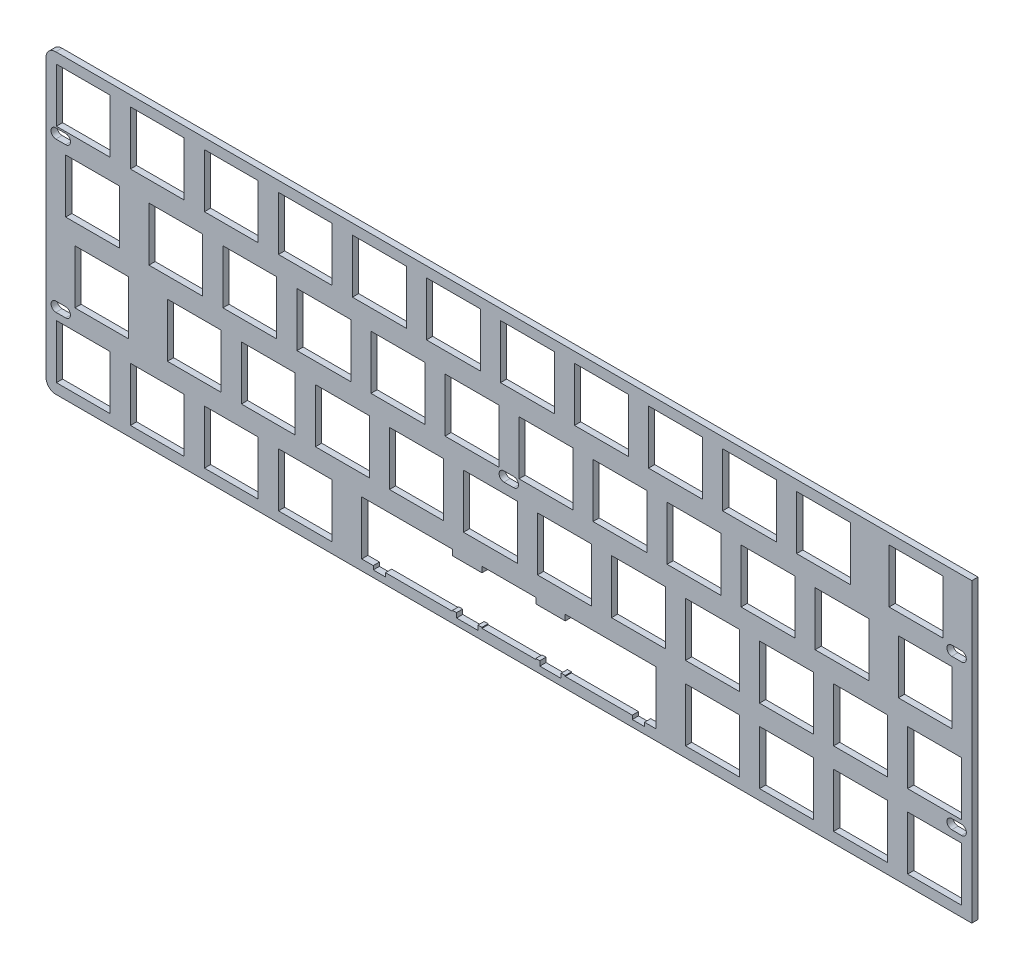
from build123d import *

# Parameters (mm, degrees)
MODEL_W             = 238.2749154
MODEL_H             = 76.350013
MODEL_W_2           = 13.849
MODEL_H_2           = 13.84926
MODEL_W_3           = 13.8491
MODEL_W_4           = 13.84934
MODEL_H_3           = 13.8492
MODEL_W_5           = 13.85
MODEL_W_6           = 13.8504
MODEL_W_7           = 13.85071
MODEL_W_8           = 13.851
MODEL_H_4           = 13.849
MODEL_W_9           = 13.8505
MODEL_W_10          = 13.84928
BOSS_EXTRUDE1_DEPTH = 1.6
FILLET1_R           = 2.5
CUT_EXTRUDE1_DEPTH  = 1.6


with BuildPart() as part:
    # Model → Boss-Extrude1 (new body)
    with BuildSketch(Plane.XY):
        with Locations((119.2325423, 38.2824935)):
            Rectangle(MODEL_W, MODEL_H)
        Polygon((81.3513, 16.6329), (81.3513, 2.78364), (84.3248, 2.78364), (84.3248, 1.8135), (87.4751, 1.8135), (87.4751, 2.78364), (104.725, 2.78364), (104.725, 3.01377), (105.756, 3.01377), (105.756, 1.8135), (111.275, 1.8135), (111.275, 3.01377), (112.306, 3.01377), (112.306, 2.78364), (126.157, 2.78364), (126.157, 3.01377), (127.187, 3.01377), (127.187, 1.8135), (132.707, 1.8135), (132.707, 3.01377), (133.737, 3.01377), (133.737, 2.78364), (150.987, 2.78364), (150.987, 1.8135), (154.138, 1.8135), (154.138, 2.78364), (157.113, 2.78364), (157.113, 16.6329), (133.737, 16.6329), (133.737, 15.1639), (126.157, 15.1639), (126.157, 16.6329), (112.306, 16.6329), (112.306, 15.1639), (104.725, 15.1639), (104.725, 16.6329), align=None, mode=Mode.SUBTRACT)
        with Locations((228.7695, 9.70827)):
            Rectangle(MODEL_W_2, MODEL_H_2, mode=Mode.SUBTRACT)
        with Locations((209.7195, 9.70827)):
            Rectangle(MODEL_W_2, MODEL_H_2, mode=Mode.SUBTRACT)
        with Locations((190.6695, 9.70827)):
            Rectangle(MODEL_W_2, MODEL_H_2, mode=Mode.SUBTRACT)
        with Locations((171.6195, 9.70827)):
            Rectangle(MODEL_W_2, MODEL_H_2, mode=Mode.SUBTRACT)
        with Locations((66.8445, 9.70827)):
            Rectangle(MODEL_W_2, MODEL_H_2, mode=Mode.SUBTRACT)
        with Locations((47.7945, 9.70827)):
            Rectangle(MODEL_W_2, MODEL_H_2, mode=Mode.SUBTRACT)
        with Locations((28.74445, 9.70827)):
            Rectangle(MODEL_W_3, MODEL_H_2, mode=Mode.SUBTRACT)
        with Locations((9.69453, 9.70827)):
            Rectangle(MODEL_W_4, MODEL_H_2, mode=Mode.SUBTRACT)
        with Locations((228.7695, 28.7582)):
            Rectangle(MODEL_W_2, MODEL_H_3, mode=Mode.SUBTRACT)
        with Locations((209.7195, 28.7582)):
            Rectangle(MODEL_W_2, MODEL_H_3, mode=Mode.SUBTRACT)
        with Locations((190.6695, 28.7582)):
            Rectangle(MODEL_W_2, MODEL_H_3, mode=Mode.SUBTRACT)
        with Locations((171.6195, 28.7582)):
            Rectangle(MODEL_W_2, MODEL_H_3, mode=Mode.SUBTRACT)
        with Locations((152.569, 28.7582)):
            Rectangle(MODEL_W_5, MODEL_H_3, mode=Mode.SUBTRACT)
        with Locations((133.519, 28.7582)):
            Rectangle(MODEL_W_5, MODEL_H_3, mode=Mode.SUBTRACT)
        with Locations((114.469, 28.7582)):
            Rectangle(MODEL_W_5, MODEL_H_3, mode=Mode.SUBTRACT)
        with Locations((95.4188, 28.7582)):
            Rectangle(MODEL_W_6, MODEL_H_3, mode=Mode.SUBTRACT)
        with Locations((76.3695, 28.7582)):
            Rectangle(MODEL_W_2, MODEL_H_3, mode=Mode.SUBTRACT)
        with Locations((57.3195, 28.7582)):
            Rectangle(MODEL_W_2, MODEL_H_3, mode=Mode.SUBTRACT)
        with Locations((38.26945, 28.7582)):
            Rectangle(MODEL_W_3, MODEL_H_3, mode=Mode.SUBTRACT)
        with Locations((14.456345, 28.7582)):
            Rectangle(MODEL_W_7, MODEL_H_3, mode=Mode.SUBTRACT)
        with Locations((226.3875, 47.8083)):
            Rectangle(MODEL_W_8, MODEL_H_4, mode=Mode.SUBTRACT)
        with Locations((204.9565, 47.8083)):
            Rectangle(MODEL_W_8, MODEL_H_4, mode=Mode.SUBTRACT)
        with Locations((185.9065, 47.8083)):
            Rectangle(MODEL_W_8, MODEL_H_4, mode=Mode.SUBTRACT)
        with Locations((166.8565, 47.8083)):
            Rectangle(MODEL_W_8, MODEL_H_4, mode=Mode.SUBTRACT)
        with Locations((147.8065, 47.8083)):
            Rectangle(MODEL_W_8, MODEL_H_4, mode=Mode.SUBTRACT)
        with Locations((128.7565, 47.8083)):
            Rectangle(MODEL_W_8, MODEL_H_4, mode=Mode.SUBTRACT)
        with Locations((109.7065, 47.8083)):
            Rectangle(MODEL_W_8, MODEL_H_4, mode=Mode.SUBTRACT)
        with Locations((90.6563, 47.8083)):
            Rectangle(MODEL_W_6, MODEL_H_4, mode=Mode.SUBTRACT)
        with Locations((71.6063, 47.8083)):
            Rectangle(MODEL_W_6, MODEL_H_4, mode=Mode.SUBTRACT)
        with Locations((52.5563, 47.8083)):
            Rectangle(MODEL_W_6, MODEL_H_4, mode=Mode.SUBTRACT)
        with Locations((33.50625, 47.8083)):
            Rectangle(MODEL_W_9, MODEL_H_4, mode=Mode.SUBTRACT)
        with Locations((12.07576, 47.8083)):
            Rectangle(MODEL_W_10, MODEL_H_4, mode=Mode.SUBTRACT)
        with Locations((224.0065, 66.8583)):
            Rectangle(MODEL_W_8, MODEL_H_4, mode=Mode.SUBTRACT)
        with Locations((200.1945, 66.8583)):
            Rectangle(MODEL_W_2, MODEL_H_4, mode=Mode.SUBTRACT)
        with Locations((181.1445, 66.8583)):
            Rectangle(MODEL_W_2, MODEL_H_4, mode=Mode.SUBTRACT)
        with Locations((162.0945, 66.8583)):
            Rectangle(MODEL_W_2, MODEL_H_4, mode=Mode.SUBTRACT)
        with Locations((143.0445, 66.8583)):
            Rectangle(MODEL_W_2, MODEL_H_4, mode=Mode.SUBTRACT)
        with Locations((123.9945, 66.8583)):
            Rectangle(MODEL_W_2, MODEL_H_4, mode=Mode.SUBTRACT)
        with Locations((104.9445, 66.8583)):
            Rectangle(MODEL_W_2, MODEL_H_4, mode=Mode.SUBTRACT)
        with Locations((85.8945, 66.8583)):
            Rectangle(MODEL_W_2, MODEL_H_4, mode=Mode.SUBTRACT)
        with Locations((66.8445, 66.8583)):
            Rectangle(MODEL_W_2, MODEL_H_4, mode=Mode.SUBTRACT)
        with Locations((47.7945, 66.8583)):
            Rectangle(MODEL_W_2, MODEL_H_4, mode=Mode.SUBTRACT)
        with Locations((28.74445, 66.8583)):
            Rectangle(MODEL_W_3, MODEL_H_4, mode=Mode.SUBTRACT)
        with Locations((9.69453, 66.8583)):
            Rectangle(MODEL_W_4, MODEL_H_4, mode=Mode.SUBTRACT)
    extrude(amount=BOSS_EXTRUDE1_DEPTH)

    # Fillet1
    fillet1_edges = [part.edges().sort_by_distance(p)[0] for p in [
        (0.0950846, 76.4575, 0.8),
        (0.0950846, 0.107487, 0.8),
    ]]
    fillet(fillet1_edges, radius=FILLET1_R)

    # Sketch10 → Cut-Extrude1 (cut)
    with BuildSketch(Plane.XY.offset(1.6)):
        with BuildLine():
            Line((233.225692575, 20.864334394), (235.727531028, 20.846785516))
            ThreePointArc((235.727531028, 20.846785516), (236.968414772, 19.588370744), (235.71, 18.347487))
            Line((235.71, 18.347487), (233.228704375, 18.364891782))
            ThreePointArc((233.228704375, 18.364891782), (231.977477169, 19.613107188), (233.225692575, 20.864334394))
        make_face()
        with BuildLine():
            Line((235.71, 57.01814), (233.2081, 57.01814))
            ThreePointArc((233.2081, 57.01814), (231.95842, 58.26782), (233.2081, 59.5175))
            Line((233.2081, 59.5175), (235.71, 59.5175))
            ThreePointArc((235.71, 59.5175), (236.95968, 58.26782), (235.71, 57.01814))
        make_face()
        with BuildLine():
            Line((120.46, 38.21814), (117.9581, 38.21814))
            ThreePointArc((117.9581, 38.21814), (116.70842, 39.46782), (117.9581, 40.7175))
            Line((117.9581, 40.7175), (120.46, 40.7175))
            ThreePointArc((120.46, 40.7175), (121.70968, 39.46782), (120.46, 38.21814))
        make_face()
        with BuildLine():
            Line((5.1369846, 57.01814), (2.6350846, 57.01814))
            ThreePointArc((2.6350846, 57.01814), (1.3854046, 58.26782), (2.6350846, 59.5175))
            Line((2.6350846, 59.5175), (5.1369846, 59.5175))
            ThreePointArc((5.1369846, 59.5175), (6.3866646, 58.26782), (5.1369846, 57.01814))
        make_face()
        with BuildLine():
            Line((5.1369846, 18.407487), (2.6350846, 18.407487))
            ThreePointArc((2.6350846, 18.407487), (1.3854046, 19.657167), (2.6350846, 20.906847))
            Line((2.6350846, 20.906847), (5.1369846, 20.906847))
            ThreePointArc((5.1369846, 20.906847), (6.3866646, 19.657167), (5.1369846, 18.407487))
        make_face()
    extrude(amount=-CUT_EXTRUDE1_DEPTH, mode=Mode.SUBTRACT)


solid = part.part
